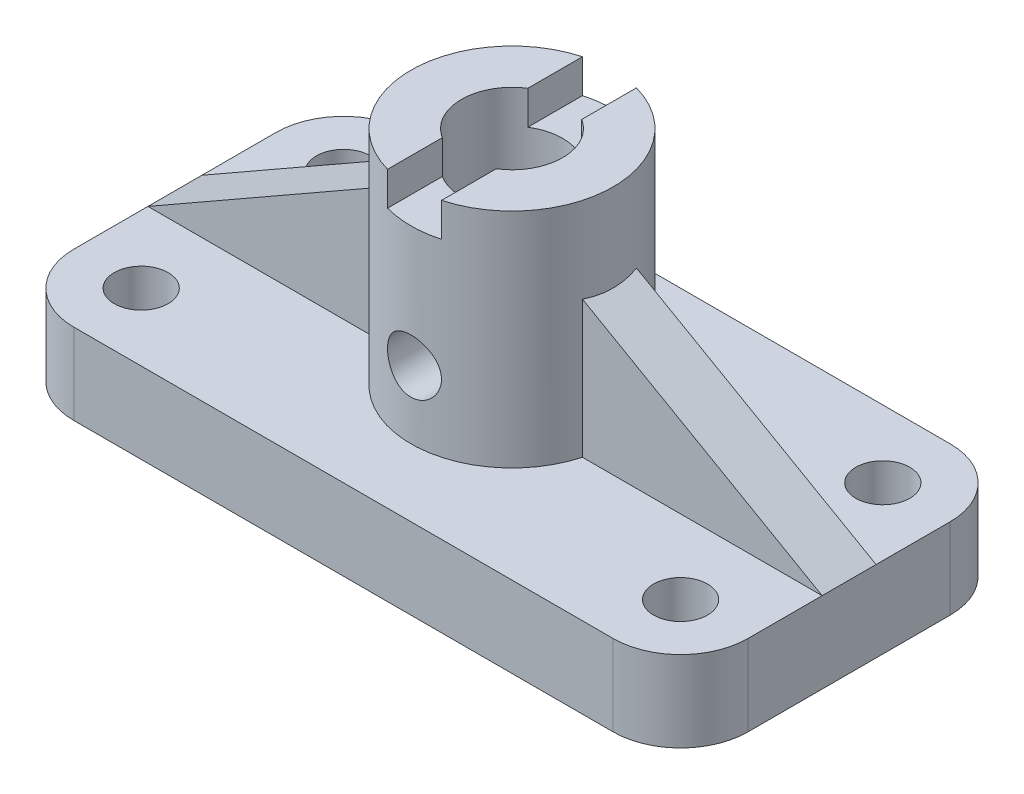
from build123d import *

# Parameters (mm, degrees)
SKETCH_1_R                = 4
EXTRUDE_2_DEPTH           = 12
SKETCH_4_R                = 15
SKETCH_4_R_2              = 7.5
EXTRUDE_3_DEPTH           = 33
CUT_EXTRUDE_12_DEPTH      = 84.815273071
CUT_EXTRUDE_12_DEPTH_BACK = 84.815273071
SKETCH_5_R                = 4
RIB_9_REACH               = 73.764
SKETCH_10_WALL_W          = 185.83828981
SKETCH_10_WALL_H          = 8
CUT_EXTRUDE_14_DEPTH      = 84.815273125
CUT_EXTRUDE_14_DEPTH_BACK = 84.815273125
CUT_EXTRUDE_15_DEPTH      = 72.763500535
CUT_EXTRUDE_15_DEPTH_BACK = 72.763500535
SKETCH_14_R               = 7.5


with BuildPart() as part:
    # 草图1 → 凸台-拉伸2 (new body)
    with BuildSketch(Plane(origin=(0, 0, 0), x_dir=(1, 0, 0), z_dir=(0, 1, 0))):
        with BuildLine():
            Line((-40, -25), (40, -25))
            ThreePointArc((40, -25), (47.071067812, -22.071067812), (50, -15))
            Line((50, -15), (50, 15))
            ThreePointArc((50, 15), (47.071067812, 22.071067812), (40, 25))
            Line((40, 25), (-40, 25))
            ThreePointArc((-40, 25), (-47.071067812, 22.071067812), (-50, 15))
            Line((-50, 15), (-50, -15))
            ThreePointArc((-50, -15), (-47.071067812, -22.071067812), (-40, -25))
        make_face()
        with Locations(Location((-40, 15, 0), (0, 0, 270))):
            Circle(SKETCH_1_R, mode=Mode.SUBTRACT)
        with Locations(Location((-40, -15, 0), (0, 0, 270))):
            Circle(SKETCH_1_R, mode=Mode.SUBTRACT)
        with Locations(Location((40, 15, 0), (0, 0, 270))):
            Circle(SKETCH_1_R, mode=Mode.SUBTRACT)
        with Locations(Location((40, -15, 0), (0, 0, 270))):
            Circle(SKETCH_1_R, mode=Mode.SUBTRACT)
    extrude(amount=EXTRUDE_2_DEPTH)

    # 草图4 → 凸台-拉伸3 (add)
    with BuildSketch(Plane(origin=(0, 12, 0), x_dir=(1, 0, 0), z_dir=(0, 1, 0))):
        with Locations(Location((0, 0, 0), (0, 0, 270))):
            Circle(SKETCH_4_R)
        with Locations(Location((0, 0, 0), (0, 0, 270))):
            Circle(SKETCH_4_R_2, mode=Mode.SUBTRACT)
    extrude(amount=EXTRUDE_3_DEPTH)

    # 草图5 → 切除-拉伸12 (cut, two sides: drawn at the far end of the back side and taken through both)
    with BuildSketch(Plane.XY.offset(25).offset(-CUT_EXTRUDE_12_DEPTH_BACK)):
        with Locations((0, 22)):
            Circle(SKETCH_5_R)
    extrude(amount=CUT_EXTRUDE_12_DEPTH + CUT_EXTRUDE_12_DEPTH_BACK, mode=Mode.SUBTRACT)

    # 草图10 wall → 筋9 (add, up to next)
    with BuildSketch(Plane(origin=(-32.5, 22, 0), x_dir=(0.868243142124, 0.496138938357, 0), z_dir=(-0.496138938357, 0.868243142124, 0)), mode=Mode.PRIVATE) as rib_9_sk1:
        Rectangle(SKETCH_10_WALL_W, SKETCH_10_WALL_H)
    rib_9_tool1 = extrude(rib_9_sk1.sketch, amount=-RIB_9_REACH, mode=Mode.PRIVATE) - part.part
    rib_9 = rib_9_tool1.solids().sort_by_distance((-32.5, 22, 0))[0]
    add(rib_9)

    # 草图13 → 切除-拉伸14 (cut, two sides: drawn at the far end of the back side and taken through both)
    with BuildSketch(Plane.XY.offset(25).offset(-CUT_EXTRUDE_14_DEPTH_BACK)):
        Polygon((0, 40), (4, 40), (4, 45), (0, 45), (-4, 45), (-4, 40), align=None)
    extrude(amount=CUT_EXTRUDE_14_DEPTH + CUT_EXTRUDE_14_DEPTH_BACK, mode=Mode.SUBTRACT)

    # 草图14 → 切除-拉伸15 (cut, two sides: drawn at the far end of the back side and taken through both)
    with BuildSketch(Plane(origin=(0, 0, 0), x_dir=(1, 0, 0), z_dir=(0, 1, 0)).offset(-CUT_EXTRUDE_15_DEPTH_BACK)):
        with Locations(Location((0, 0, 0), (0, 0, 122.230952636))):
            Circle(SKETCH_14_R)
    extrude(amount=CUT_EXTRUDE_15_DEPTH + CUT_EXTRUDE_15_DEPTH_BACK, mode=Mode.SUBTRACT)

    # 镜向1: 筋9 across plane
    add(rib_9.mirror(Plane(origin=(0, 0, 0), x_dir=(0, 0, 1), z_dir=(1, 0, 0))))


solid = part.part
